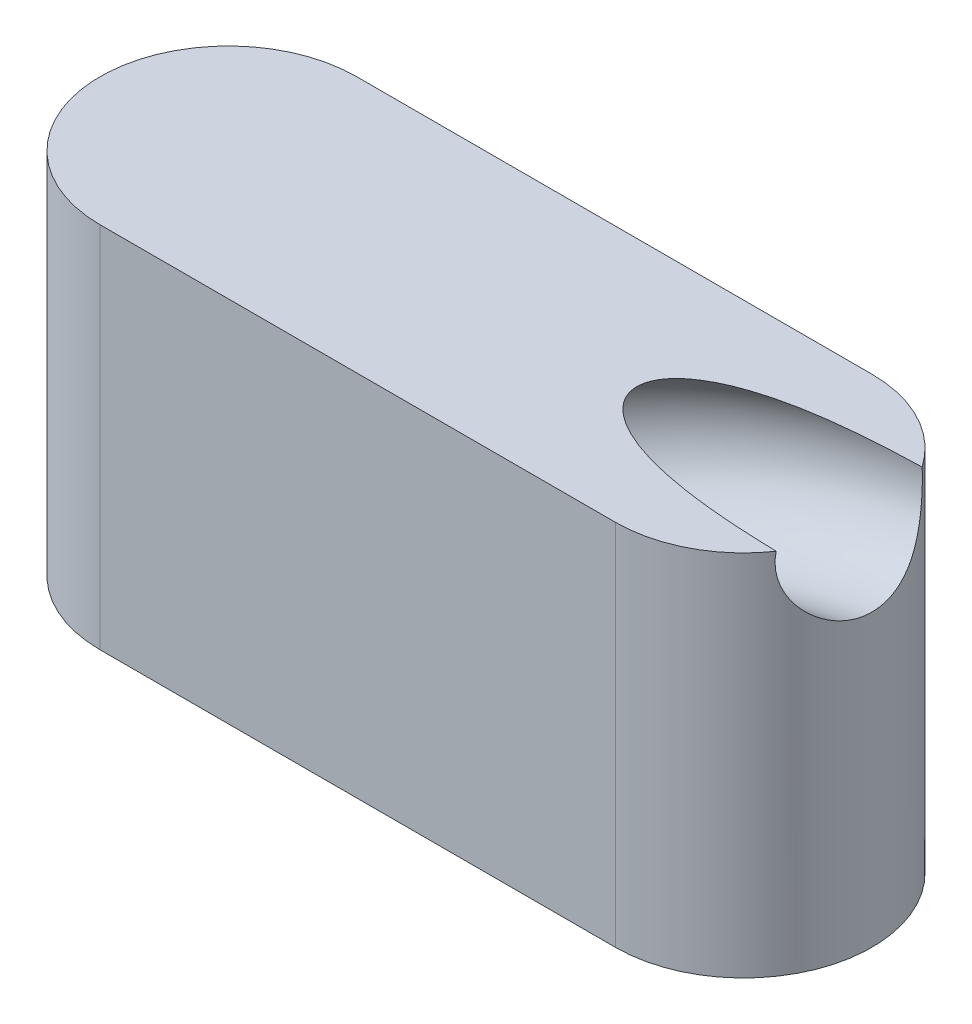
from build123d import *

# Parameters (mm, degrees)
BOSS_EXTRUDE1_DEPTH = 1
SKETCH4_R           = 0.2


with BuildPart() as part:
    # Sketch1 → Boss-Extrude1 (new body)
    with BuildSketch(Plane(origin=(0, 0, 0), x_dir=(1, 0, 0), z_dir=(0, 1, 0))):
        with BuildLine():
            Line((-1.037204748, 0.3484375), (0.362795252, 0.3484375))
            ThreePointArc((0.362795252, 0.3484375), (0.711232752, 0), (0.362795252, -0.3484375))
            Line((0.362795252, -0.3484375), (-1.037204748, -0.3484375))
            ThreePointArc((-1.037204748, -0.3484375), (-1.385642248, 0), (-1.037204748, 0.3484375))
        make_face()
    extrude(amount=BOSS_EXTRUDE1_DEPTH)

    # Cut-Sweep3: sweep along a path in Sketch2
    with BuildLine(Plane.XY) as cut_sweep3_path:
        ThreePointArc((-1.385642248, 0), (-0.891042659, 0.184490952), (-0.445928668, 0.468285243))
        ThreePointArc((-0.445928668, 0.468285243), (0.147274351, 0.820781614), (0.813625821, 1))
    # Sketch4 → Cut-Sweep3 (sweep, cut)
    with BuildSketch(Plane(origin=(-1.385642248, 1, 0), x_dir=(0, 0, 1), z_dir=(-1, 0, 0))):
        with Locations((0, -1)):
            Circle(SKETCH4_R)
    sweep(path=cut_sweep3_path.line, mode=Mode.SUBTRACT)


solid = part.part
